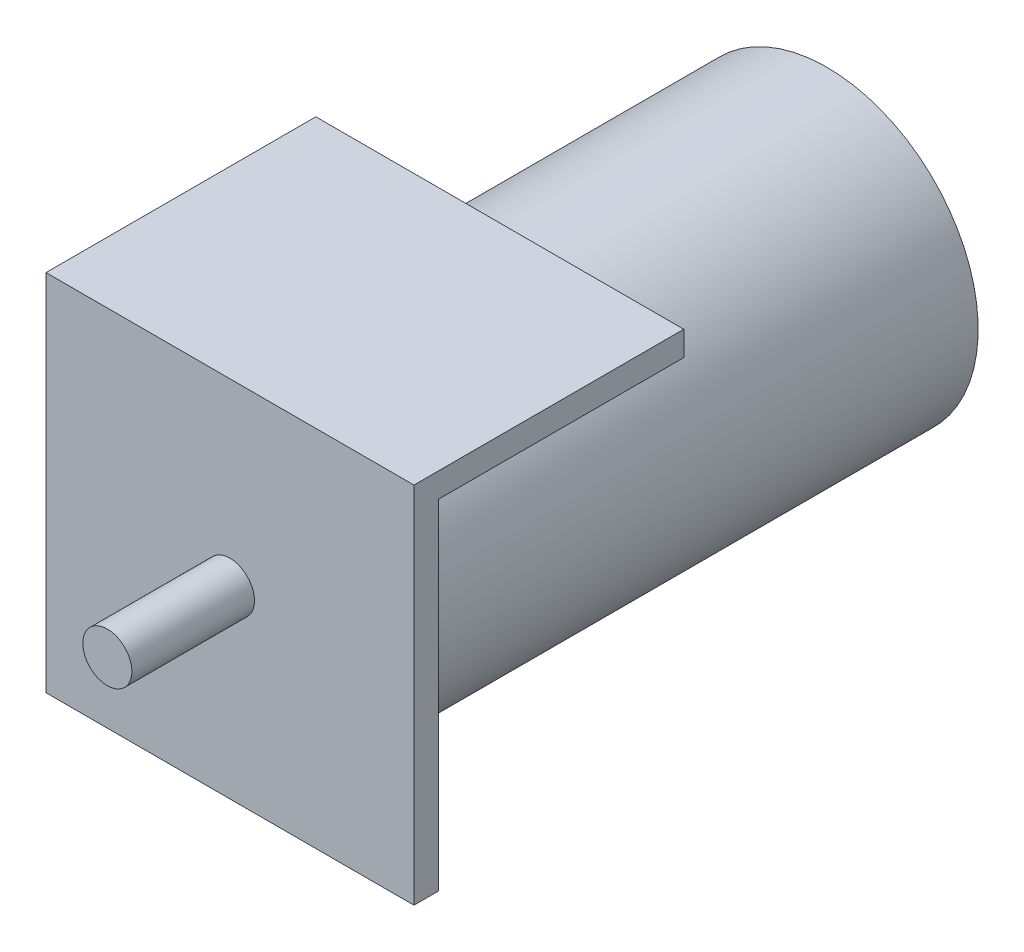
from build123d import *

# Parameters (mm, degrees)
SK_BRACKET_FACE_W  = 3
SK_BRACKET_FACE_H  = 44.5
BRACKET_FACE_DEPTH = 22.5
SK_BRACKET_TOP_W   = 33
SK_BRACKET_TOP_H   = 3
BRACKET_TOP_DEPTH  = 22.5


with BuildPart() as part:
    # SK_Gearmotor → Gearmotor (revolve)
    with BuildSketch(Plane(origin=(0, 0, 0), x_dir=(1, 0, 0), z_dir=(0, 1, 0)), mode=Mode.PRIVATE) as gearmotor_sk:
        Polygon((0, -18), (3, -18), (3, 0), (18.5, 0), (18.5, 70), (0, 70), align=None)
    revolve(gearmotor_sk.sketch.rotate(Axis((0, 0, -75), (0, 0, 1)), 180), axis=Axis((0, 0, -75), (0, 0, 1)))

    # SK_Bracket_Face → Bracket_Face (add, symmetric)
    with BuildSketch(Plane(origin=(0, 0, 0), x_dir=(0, 0, -1), z_dir=(1, 0, 0))):
        with Locations((-1.5, -0.25)):
            Rectangle(SK_BRACKET_FACE_W, SK_BRACKET_FACE_H)
    extrude(amount=BRACKET_FACE_DEPTH, both=True)

    # SK_Bracket_Top → Bracket_Top (add, symmetric)
    with BuildSketch(Plane(origin=(0, 0, 0), x_dir=(0, 0, -1), z_dir=(1, 0, 0))):
        with Locations((13.5, 20.5)):
            Rectangle(SK_BRACKET_TOP_W, SK_BRACKET_TOP_H)
    extrude(amount=BRACKET_TOP_DEPTH, both=True)


solid = part.part
